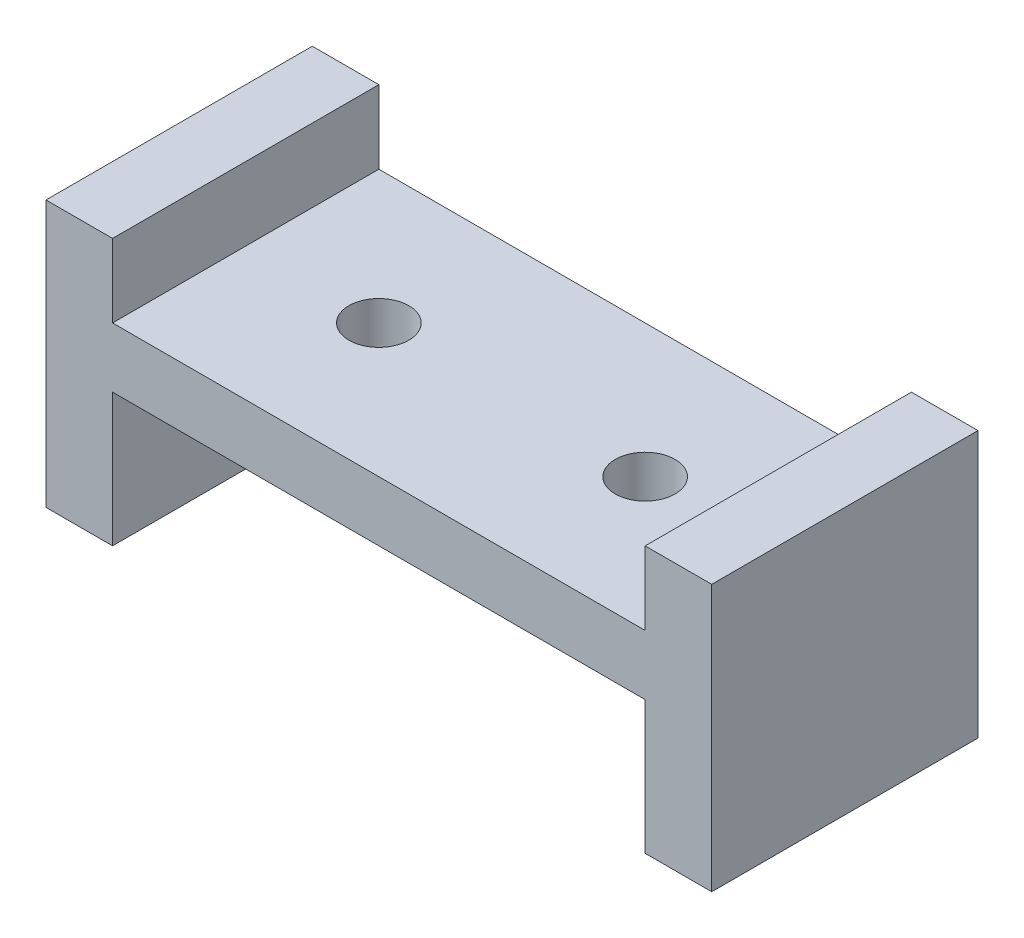
from build123d import *

# Parameters (mm, degrees)
CROQUIS1_R              = 2.25
SALIENTE_EXTRUIR1_DEPTH = 4.5
CROQUIS3_W              = 5
CROQUIS3_H              = 20
SALIENTE_EXTRUIR3_DEPTH = 5.5
CROQUIS4_W              = 5
CROQUIS4_H              = 20
SALIENTE_EXTRUIR4_DEPTH = 10


with BuildPart() as part:
    # Croquis1 → Saliente-Extruir1 (new body)
    with BuildSketch(Plane(origin=(0, 0, 0), x_dir=(1, 0, 0), z_dir=(0, 1, 0))):
        Polygon((-35, -175), (-45, -175), (-45, -195), (-35, -195), (-5, -195), (5, -195), (5, -175), (-5, -175), align=None)
        with Locations(Location((-30, -185, 0), (0, 0, 270))):
            Circle(CROQUIS1_R, mode=Mode.SUBTRACT)
        with Locations(Location((-10, -185, 0), (0, 0, 270))):
            Circle(CROQUIS1_R, mode=Mode.SUBTRACT)
    extrude(amount=SALIENTE_EXTRUIR1_DEPTH)

    # Croquis3 → Saliente-Extruir3 (add)
    with BuildSketch(Plane(origin=(0, 4.5, 0), x_dir=(1, 0, 0), z_dir=(0, 1, 0))):
        with Locations((2.5, -185)):
            Rectangle(CROQUIS3_W, CROQUIS3_H)
        with Locations((-42.5, -185)):
            Rectangle(CROQUIS3_W, CROQUIS3_H)
    extrude(amount=SALIENTE_EXTRUIR3_DEPTH)

    # Croquis4 → Saliente-Extruir4 (add)
    with BuildSketch(Plane.XZ):
        with Locations((2.5, 185)):
            Rectangle(CROQUIS4_W, CROQUIS4_H)
        Polygon((-40, 175), (-40, 195), (-45, 195), (-45, 175), (-40.824678474, 175), align=None)
    extrude(amount=SALIENTE_EXTRUIR4_DEPTH)


solid = part.part
